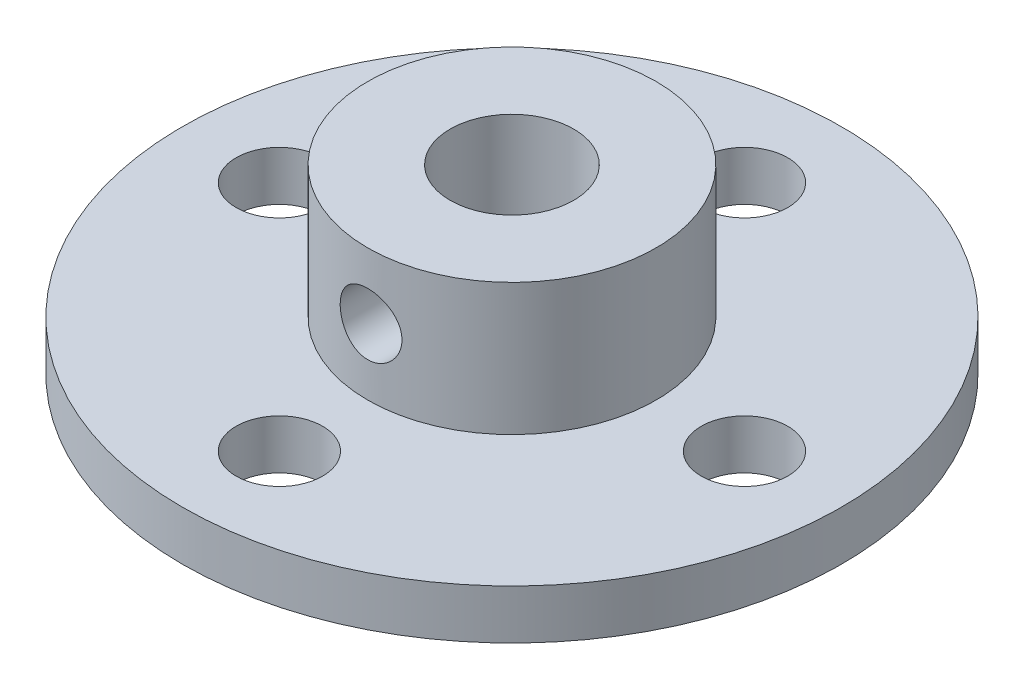
from build123d import *

# Parameters (mm, degrees)
SKETCH_1_R               = 16
EXTRUDE_1_DEPTH          = 2.4
SKETCH_2_R               = 7
EXTRUDE_2_DEPTH          = 6.4
CUT_EXTRUDE_1_REACH      = 26.278
SKETCH_3_R               = 3
CUT_EXTRUDE_2_REACH      = 25.515
SKETCH_4_R               = 2.1
CUT_EXTRUDE_3_REACH      = 26.278
CUT_EXTRUDE_3_END_RADIUS = 7
SKETCH_5_R               = 1.5


with BuildPart() as part:
    # 草圖1 → 填料-伸長1 (new body)
    with BuildSketch(Plane(origin=(0, 0, 0), x_dir=(1, 0, 0), z_dir=(0, 1, 0))):
        with Locations(Location((0, 0, 0), (0, 0, 270))):
            Circle(SKETCH_1_R)
    extrude(amount=EXTRUDE_1_DEPTH)

    # 草圖2 → 填料-伸長2 (add)
    with BuildSketch(Plane(origin=(0, 2.4, 0), x_dir=(1, 0, 0), z_dir=(0, 1, 0))):
        with Locations(Location((0, 0, 0), (0, 0, 270))):
            Circle(SKETCH_2_R)
    extrude(amount=EXTRUDE_2_DEPTH)

    # 草圖3 → 除料-伸長1 (cut, up to next)
    with BuildSketch(Plane(origin=(0, 8.8, 0), x_dir=(1, 0, 0), z_dir=(0, 1, 0)), mode=Mode.PRIVATE) as cut_extrude_1_sk1:
        with Locations(Location((0, 0, 0), (0, 0, 270))):
            Circle(SKETCH_3_R)
    cut_extrude_1_tool1 = extrude(cut_extrude_1_sk1.sketch, amount=-CUT_EXTRUDE_1_REACH, mode=Mode.PRIVATE) & part.part
    add(cut_extrude_1_tool1.solids().sort_by_distance((0, 8.8, 0))[0], mode=Mode.SUBTRACT)

    # 草圖4 → 除料-伸長2 (cut, up to next)
    with BuildSketch(Plane(origin=(0, 2.4, 0), x_dir=(1, 0, 0), z_dir=(0, 1, 0)), mode=Mode.PRIVATE) as cut_extrude_2_sk1:
        with Locations(Location((0, 11.29, 0), (0, 0, 270))):
            Circle(SKETCH_4_R)
    cut_extrude_2_tool1 = extrude(cut_extrude_2_sk1.sketch, amount=-CUT_EXTRUDE_2_REACH, mode=Mode.PRIVATE) & part.part
    # 草圖4 → 除料-伸長2 (cut, up to next)
    with BuildSketch(Plane(origin=(0, 2.4, 0), x_dir=(1, 0, 0), z_dir=(0, 1, 0)), mode=Mode.PRIVATE) as cut_extrude_2_sk2:
        with Locations(Location((11.29, 0, 0), (0, 0, 270))):
            Circle(SKETCH_4_R)
    cut_extrude_2_tool2 = extrude(cut_extrude_2_sk2.sketch, amount=-CUT_EXTRUDE_2_REACH, mode=Mode.PRIVATE) & part.part
    # 草圖4 → 除料-伸長2 (cut, up to next)
    with BuildSketch(Plane(origin=(0, 2.4, 0), x_dir=(1, 0, 0), z_dir=(0, 1, 0)), mode=Mode.PRIVATE) as cut_extrude_2_sk3:
        with Locations(Location((0, -11.29, 0), (0, 0, 270))):
            Circle(SKETCH_4_R)
    cut_extrude_2_tool3 = extrude(cut_extrude_2_sk3.sketch, amount=-CUT_EXTRUDE_2_REACH, mode=Mode.PRIVATE) & part.part
    # 草圖4 → 除料-伸長2 (cut, up to next)
    with BuildSketch(Plane(origin=(0, 2.4, 0), x_dir=(1, 0, 0), z_dir=(0, 1, 0)), mode=Mode.PRIVATE) as cut_extrude_2_sk4:
        with Locations(Location((-11.29, 0, 0), (0, 0, 270))):
            Circle(SKETCH_4_R)
    cut_extrude_2_tool4 = extrude(cut_extrude_2_sk4.sketch, amount=-CUT_EXTRUDE_2_REACH, mode=Mode.PRIVATE) & part.part
    add(cut_extrude_2_tool1.solids().sort_by_distance((0, 2.4, -11.29))[0], mode=Mode.SUBTRACT)
    add(cut_extrude_2_tool2.solids().sort_by_distance((11.29, 2.4, 0))[0], mode=Mode.SUBTRACT)
    add(cut_extrude_2_tool3.solids().sort_by_distance((0, 2.4, 11.29))[0], mode=Mode.SUBTRACT)
    add(cut_extrude_2_tool4.solids().sort_by_distance((-11.29, 2.4, 0))[0], mode=Mode.SUBTRACT)

    # 除料-伸長3: up to this cylinder (the profile starts inside it)
    cut_extrude_3_end = Plane(origin=(0, 5.6, 0), z_dir=(0, -1, 0)) * Cylinder(CUT_EXTRUDE_3_END_RADIUS, 67.556, mode=Mode.PRIVATE)
    # 草圖5 → 除料-伸長3 (cut, up to the surface)
    with BuildSketch(Plane.XY, mode=Mode.PRIVATE) as cut_extrude_3_sk1:
        with Locations(Location((0, 5.6, 0), (0, 0, 180))):
            Circle(SKETCH_5_R)
    cut_extrude_3_tool1 = extrude(cut_extrude_3_sk1.sketch, amount=CUT_EXTRUDE_3_REACH, mode=Mode.PRIVATE) & cut_extrude_3_end
    add(cut_extrude_3_tool1.solids().sort_by_distance((0, 5.6, 0))[0], mode=Mode.SUBTRACT)


solid = part.part
